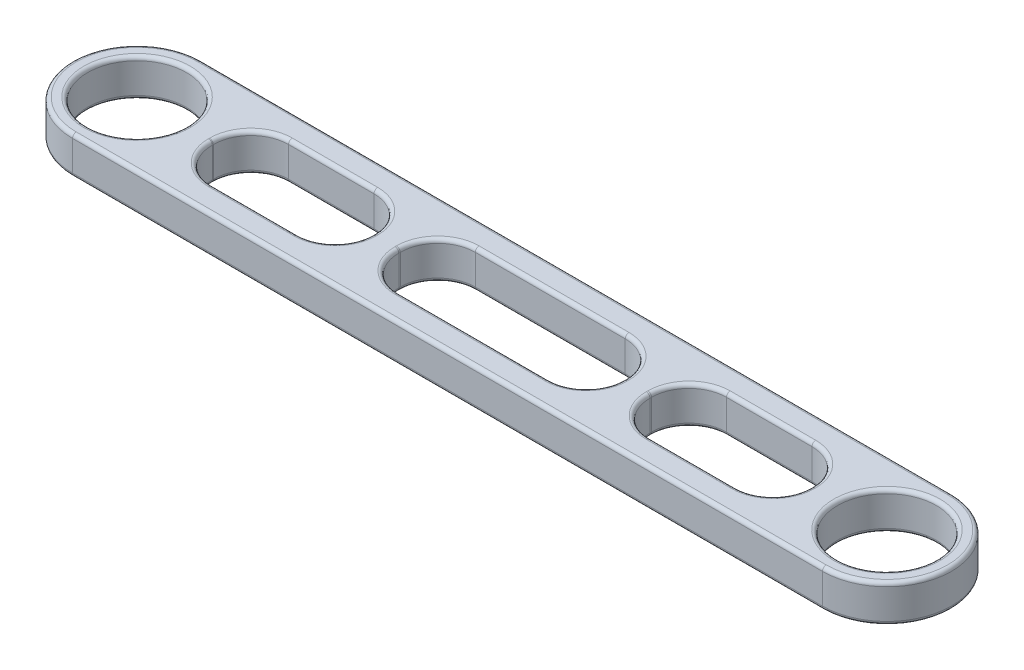
from build123d import *

# Parameters (mm, degrees)
ESQUISSE1_R        = 6.6
ESQUISSE1_W        = 30
ESQUISSE1_H        = 10.2
BOSS_EXTRU_1_DEPTH = 5
CONG_3_R           = 5
CONG_2_R           = 0.5


with BuildPart() as part:
    # Esquisse1 → Boss.-Extru.1 (new body)
    with BuildSketch(Plane(origin=(0, 0, 0), x_dir=(1, 0, 0), z_dir=(0, 1, 0))):
        with BuildLine():
            Line((-50, 8.6), (50, 8.6))
            ThreePointArc((50, 8.6), (58.6, 0), (50, -8.6))
            Line((50, -8.6), (-50, -8.6))
            ThreePointArc((-50, -8.6), (-58.6, 0), (-50, 8.6))
        make_face()
        with Locations(Location((-50, 0, 0), (0, 0, 270))):
            Circle(ESQUISSE1_R, mode=Mode.SUBTRACT)
        with Locations(Location((50, 0, 0), (0, 0, 270))):
            Circle(ESQUISSE1_R, mode=Mode.SUBTRACT)
        with BuildLine():
            Line((-41.282202113, 5.1), (-18.5, 5.1))
            Line((-18.5, 5.1), (-18.5, -5.1))
            Line((-18.5, -5.1), (-41.282202113, -5.1))
            ThreePointArc((-41.282202113, -5.1), (-39.9, 0), (-41.282202113, 5.1))
        make_face(mode=Mode.SUBTRACT)
        with BuildLine():
            Line((41.282202113, 5.1), (18.5, 5.1))
            Line((18.5, 5.1), (18.5, -5.1))
            Line((18.5, -5.1), (41.282202113, -5.1))
            ThreePointArc((41.282202113, -5.1), (39.9, 0), (41.282202113, 5.1))
        make_face(mode=Mode.SUBTRACT)
        Rectangle(ESQUISSE1_W, ESQUISSE1_H, mode=Mode.SUBTRACT)
    extrude(amount=BOSS_EXTRU_1_DEPTH)

    # Congé3
    cong_3_edges = [part.edges().sort_by_distance(p)[0] for p in [
        (-41.282202113, 2.5, -5.1),
        (-41.282202113, 2.5, 5.1),
        (-18.5, 2.5, 5.1),
        (-18.5, 2.5, -5.1),
        (15, 2.5, -5.1),
        (-15, 2.5, -5.1),
        (-15, 2.5, 5.1),
        (15, 2.5, 5.1),
        (18.5, 2.5, -5.1),
        (18.5, 2.5, 5.1),
        (41.282202113, 2.5, 5.1),
        (41.282202113, 2.5, -5.1),
    ]]
    fillet(cong_3_edges, radius=CONG_3_R)

    # Congé2
    cong_2_edges = [part.edges().sort_by_distance(p)[0] for p in [
        (58.6, 5, 0),
        (-38.447552783, 0, 3.623807393),
        (-38.447552783, 5, 3.623807393),
        (0, 5, -8.6),
        (50, 0, -6.6),
        (50, 5, -6.6),
        (-50, 0, -6.6),
        (-50, 5, -6.6),
        (-58.6, 5, 0),
        (0, 0, -8.6),
        (58.6, 0, 0),
        (0, 0, 8.6),
        (-58.6, 0, 0),
        (-29.200165565, 0, 5.1),
        (-29.200165565, 5, 5.1),
        (-18.5, 0, 0),
        (-18.5, 5, 0),
        (-15, 0, 0),
        (0, 5, 8.6),
        (-15, 5, 0),
        (0, 0, 5.1),
        (0, 5, 5.1),
        (15, 0, 0),
        (15, 5, 0),
        (0, 0, -5.1),
        (0, 5, -5.1),
        (-29.200165565, 0, -5.1),
        (-29.200165565, 5, -5.1),
        (39.9, 0, 0),
        (39.9, 5, 0),
        (29.200165565, 0, -5.1),
        (29.200165565, 5, -5.1),
        (29.200165565, 0, 5.1),
        (29.200165565, 5, 5.1),
        (18.5, 0, 0),
        (18.5, 5, 0),
        (-39.9, 0, 0),
        (-39.9, 5, 0),
        (-19.964466094, 0, 3.635533906),
        (-19.964466094, 5, 3.635533906),
        (-13.535533906, 0, 3.635533906),
        (-13.535533906, 5, 3.635533906),
        (13.535533906, 0, -3.635533906),
        (13.535533906, 5, -3.635533906),
        (13.535533906, 0, 3.635533906),
        (13.535533906, 5, 3.635533906),
        (-13.535533906, 0, -3.635533906),
        (-13.535533906, 5, -3.635533906),
        (-19.964466094, 0, -3.635533906),
        (-19.964466094, 5, -3.635533906),
        (38.447552783, 0, -3.623807393),
        (38.447552783, 5, -3.623807393),
        (38.447552783, 0, 3.623807393),
        (38.447552783, 5, 3.623807393),
        (19.964466094, 0, 3.635533906),
        (19.964466094, 5, 3.635533906),
        (19.964466094, 0, -3.635533906),
        (19.964466094, 5, -3.635533906),
        (-38.447552783, 0, -3.623807393),
        (-38.447552783, 5, -3.623807393),
    ]]
    fillet(cong_2_edges, radius=CONG_2_R)


solid = part.part
